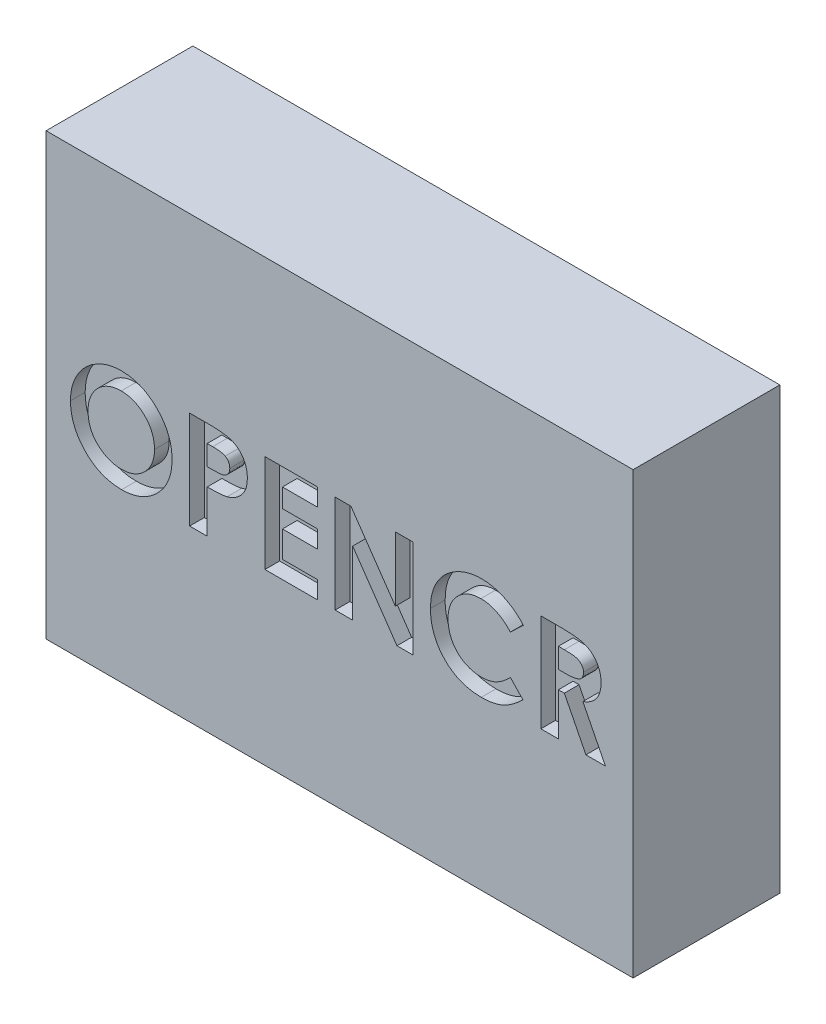
from build123d import *

# Parameters (mm, degrees)
SKETCH_1_W          = 120
SKETCH_1_H          = 90
EXTRUDE_1_DEPTH     = 30
CUT_EXTRUDE_1_DEPTH = 3


with BuildPart() as part:
    # ｽｹｯﾁ1 → ﾎﾞｽ - 押し出し1 (new body)
    with BuildSketch(Plane.XY):
        with Locations((60, 45)):
            Rectangle(SKETCH_1_W, SKETCH_1_H)
    extrude(amount=EXTRUDE_1_DEPTH)

    # ｽｹｯﾁ2 → ｶｯﾄ - 押し出し1 (cut)
    # profile 1 of 6: a face of its own
    with BuildSketch(Plane.XY.offset(30)):
        with BuildLine():
            add(Edge.make_bspline(
                [(15.404571472, 55.195485173), (15.752295983, 55.186481963), (16.438782926, 55.168707587), (17.448357493, 55.020544288), (18.421269257, 54.779133434), (19.357078271, 54.443554885), (20.253441377, 54.00471947), (21.113520348, 53.47506846), (21.934234421, 52.84460501), (22.707173578, 52.128036792), (23.421508761, 51.348800144), (24.040480614, 50.509813354), (24.568317103, 49.632815414), (25.005789397, 48.715456382), (25.339005976, 47.75138311), (25.572837832, 46.745511096), (25.723063215, 45.698126502), (25.740341445, 44.985000353), (25.749122754, 44.622568507)],
                knots=[0, 0, 0, 0, 1.014329547, 2.002516266, 2.970391464, 3.935626869, 4.897733899, 5.877609409, 6.878433252, 7.912639331, 8.949961323, 9.958554974, 10.949718813, 11.932905612, 12.9188844, 13.919928257, 14.942845884, 16, 16, 16, 16], degree=3))
            add(Edge.make_bspline(
                [(25.749122754, 44.622568507), (25.73977104, 44.26422043), (25.721343188, 43.558084047), (25.57897069, 42.520351514), (25.341201076, 41.525254485), (25.013636111, 40.570540535), (24.584097911, 39.660833971), (24.066554808, 38.790326442), (23.447349825, 37.967096467), (22.749067799, 37.191585823), (21.980319888, 36.487643508), (21.166093813, 35.867295557), (20.310149167, 35.341636115), (19.41373878, 34.910905957), (18.474940342, 34.576632144), (17.496072802, 34.34077768), (16.47719673, 34.19744416), (15.784311591, 34.179136676), (15.432616344, 34.169844148)],
                knots=[0, 0, 0, 0, 1.051557043, 2.072126891, 3.067553643, 4.050577992, 5.02905126, 6.015227836, 7.017913613, 8.04756643, 9.074058332, 10.072836633, 11.047628519, 12.017157415, 12.98668631, 13.966869689, 14.968021931, 16, 16, 16, 16], degree=3))
            add(Edge.make_bspline(
                [(15.432616344, 34.169844148), (15.064785285, 34.178180004), (14.342047533, 34.194558822), (13.284317597, 34.350313903), (12.270920923, 34.584935466), (11.310370626, 34.935095562), (10.392884322, 35.372825125), (9.525203054, 35.911915326), (8.707618419, 36.551475276), (7.944820215, 37.275125608), (7.253723196, 38.066957792), (6.643694517, 38.903458275), (6.129121793, 39.778236929), (5.709986199, 40.69170317), (5.379556533, 41.638180026), (5.146475948, 42.623431816), (5.008789684, 43.645095548), (4.989610787, 44.339029978), (4.979891985, 44.690677481)],
                knots=[0, 0, 0, 0, 1.067978421, 2.098431617, 3.099715153, 4.085208694, 5.062210972, 6.048429807, 7.046490867, 8.072918869, 9.098532598, 10.095778865, 11.076610158, 12.041847152, 13.011192615, 13.984257998, 14.978533688, 16, 16, 16, 16], degree=3))
            add(Edge.make_bspline(
                [(4.979891985, 44.690677481), (4.982942305, 44.927247512), (4.98900432, 45.397392056), (5.062027687, 46.094122271), (5.167160339, 46.777253248), (5.322646543, 47.444061334), (5.511522541, 48.099250548), (5.756238077, 48.736722229), (6.034790582, 49.363286327), (6.360252958, 49.971542334), (6.722135651, 50.555893788), (7.116981888, 51.113584201), (7.545784505, 51.63787028), (8.007162187, 52.132197417), (8.502704903, 52.593316365), (9.025894301, 53.027754904), (9.586877209, 53.423972802), (10.173375472, 53.79164649), (10.782082546, 54.124127429), (11.410520443, 54.407125262), (12.045742099, 54.654262448), (12.69623322, 54.849314043), (13.355022635, 55.008181527), (14.029148177, 55.11324332), (14.712519502, 55.186264664), (15.173340023, 55.192404376), (15.404571472, 55.195485173)],
                knots=[0, 0, 0, 0, 1.034744296, 2.056386356, 3.06226378, 4.057406941, 5.050368692, 6.043467995, 7.042652155, 8.049140477, 9.059438543, 10.048523776, 11.036952808, 12.020949711, 13.004946614, 13.997082645, 14.994316842, 16.007702937, 17.024872941, 18.026463647, 19.021641123, 20.005082605, 20.995858141, 21.984425357, 22.988620895, 24, 24, 24, 24], degree=3))
        make_face()
        with BuildLine():
            add(Edge.make_bspline(
                [(15.348481728, 51.605741584), (15.114463178, 51.59946234), (14.652604206, 51.587069627), (13.975141206, 51.492653914), (13.324752801, 51.341861288), (12.705044352, 51.123440013), (12.113329988, 50.845445164), (11.548560782, 50.508848091), (11.018557622, 50.102078644), (10.516253426, 49.646974463), (10.06250424, 49.139883815), (9.661602521, 48.596449947), (9.326112354, 48.017580382), (9.045137237, 47.408652684), (8.833625247, 46.762819621), (8.682971598, 46.085140073), (8.587764116, 45.374446365), (8.575763094, 44.889967389), (8.569635574, 44.642600558)],
                knots=[0, 0, 0, 0, 1.033739768, 2.040188636, 3.016340934, 3.979330865, 4.937572243, 5.900995986, 6.878200029, 7.884839167, 8.891893314, 9.879764717, 10.863503415, 11.843163062, 12.837761627, 13.859916423, 14.907309254, 16, 16, 16, 16], degree=3))
            add(Edge.make_bspline(
                [(8.569635574, 44.642600558), (8.577759731, 44.368462464), (8.59368173, 43.831197223), (8.705710858, 43.047449165), (8.897381544, 42.307276912), (9.174150288, 41.614300534), (9.517416141, 40.960825048), (9.943697852, 40.354859726), (10.446091673, 39.79277633), (10.833131803, 39.46460863), (11.029571472, 39.298049276)],
                knots=[0, 0, 0, 0, 1.078454662, 2.113592447, 3.107694534, 4.079536787, 5.043276885, 6.005368276, 6.987637804, 8, 8, 8, 8], degree=3))
            add(Edge.make_bspline(
                [(11.029571472, 39.298049276), (11.190493063, 39.175001622), (11.508710656, 38.931678598), (12.016655215, 38.619810227), (12.539738091, 38.352507923), (13.081906602, 38.136530823), (13.642015714, 37.966646866), (14.219988621, 37.847679925), (14.815006382, 37.773017881), (15.217385278, 37.764094352), (15.420597113, 37.759587737)],
                knots=[0, 0, 0, 0, 1.023928204, 2.024787132, 3.009472467, 3.9914905, 4.972207045, 5.96565515, 6.972602802, 8, 8, 8, 8], degree=3))
            add(Edge.make_bspline(
                [(15.420597113, 37.759587737), (15.650591708, 37.765920222), (16.103113308, 37.778379583), (16.767964969, 37.871632987), (17.404913053, 38.029451416), (18.017911788, 38.245956623), (18.605193559, 38.527441937), (19.163888161, 38.874479196), (19.694975138, 39.282807229), (20.196639404, 39.743887925), (20.655184258, 40.252976159), (21.055249379, 40.799308648), (21.401406457, 41.370848051), (21.676538692, 41.975683643), (21.896407043, 42.608106058), (22.045247496, 43.270916159), (22.141259266, 43.961381592), (22.153263669, 44.43126772), (22.159379164, 44.67064543)],
                knots=[0, 0, 0, 0, 1.026359118, 2.019393844, 2.989460624, 3.950973911, 4.916101784, 5.890408035, 6.881132271, 7.902007068, 8.92769091, 9.933912415, 10.920395702, 11.90457117, 12.894218921, 13.903490204, 14.931958862, 16, 16, 16, 16], degree=3))
            add(Edge.make_bspline(
                [(22.159379164, 44.67064543), (22.153052072, 44.908646652), (22.140598155, 45.377115761), (22.04718062, 46.065806011), (21.890363035, 46.725690001), (21.673207685, 47.357845388), (21.395911803, 47.962891922), (21.053007314, 48.538701899), (20.645697428, 49.084718653), (20.183356355, 49.597221289), (19.680126514, 50.068178383), (19.139858997, 50.476883529), (18.577671097, 50.832035306), (17.980663478, 51.110246868), (17.361050419, 51.331897428), (16.715051006, 51.495124082), (16.040218478, 51.586406352), (15.581115956, 51.599239057), (15.348481728, 51.605741584)],
                knots=[0, 0, 0, 0, 1.055025985, 2.07665775, 3.074803781, 4.057872707, 5.035505728, 6.020516407, 7.023567878, 8.050795229, 9.077271434, 10.074415901, 11.050397877, 12.019801805, 12.988065821, 13.964604439, 14.968634123, 16, 16, 16, 16], degree=3))
        make_face(mode=Mode.SUBTRACT)
    # profile 2 of 6: a face of its own
    with BuildSketch(Plane.XY.offset(30)):
        with BuildLine():
            Line((29.338866344, 54.68266466), (33.3452766, 54.68266466))
            add(Edge.make_bspline(
                [(33.3452766, 54.68266466), (33.607050249, 54.681492906), (34.112066488, 54.679232346), (34.840341455, 54.651820047), (35.51221077, 54.602695537), (36.127520073, 54.541985411), (36.686016363, 54.456872178), (37.188399046, 54.35929652), (37.634772377, 54.240420969), (38.03016988, 54.099317339), (38.385026368, 53.932961671), (38.720835057, 53.75578101), (39.030006633, 53.54432214), (39.328145922, 53.321375201), (39.598207784, 53.065642156), (39.857040297, 52.794142411), (40.093681196, 52.496108509), (40.309226989, 52.17514807), (40.504760236, 51.837191072), (40.675591161, 51.481633346), (40.814159641, 51.107912261), (40.930401365, 50.718445366), (41.023767851, 50.313249636), (41.085915556, 49.88983308), (41.128129404, 49.451152155), (41.131854193, 49.15258564), (41.133738139, 49.001574917)],
                knots=[0, 0, 0, 0, 1.698747864, 3.27724071, 4.728299578, 6.070144658, 7.288476769, 8.393259625, 9.389771311, 10.283485332, 11.113357557, 11.931608583, 12.74405601, 13.541433047, 14.344816069, 15.154114104, 15.974336324, 16.810834471, 17.661136416, 18.50621059, 19.367396281, 20.244825668, 21.142564693, 22.063065223, 23.020325768, 24, 24, 24, 24], degree=3))
            add(Edge.make_bspline(
                [(41.133738139, 49.001574917), (41.131012305, 48.83451535), (41.125655707, 48.506222771), (41.073143785, 48.024986127), (40.983436832, 47.566170558), (40.866194536, 47.125906789), (40.702708492, 46.711438136), (40.515933364, 46.312875249), (40.286140714, 45.941392608), (40.023565875, 45.592343413), (39.736804195, 45.262889729), (39.419047964, 44.962543909), (39.076353752, 44.689258504), (38.710705295, 44.440169464), (38.320729836, 44.215779255), (37.906708764, 44.013986702), (37.465814907, 43.841245756), (37.15878969, 43.75090364), (37.003129164, 43.705100558)],
                knots=[0, 0, 0, 0, 1.102006807, 2.165578795, 3.188629044, 4.184801286, 5.166646146, 6.124351954, 7.085497154, 8.042432466, 9.003981491, 9.963833307, 10.922997304, 11.89326795, 12.880200226, 13.889073926, 14.929769137, 16, 16, 16, 16], degree=3))
            add(Edge.make_bspline(
                [(37.003129164, 43.705100558), (36.900602188, 43.67959168), (36.678495741, 43.624331237), (36.310970576, 43.568228017), (35.887436411, 43.516644555), (35.406523684, 43.472314815), (34.867955138, 43.442180921), (34.272252246, 43.41864769), (33.619145047, 43.401536601), (33.165000127, 43.400929424), (32.928609933, 43.400613378)],
                knots=[0, 0, 0, 0, 0.618981996, 1.340914327, 2.176866532, 3.120127938, 4.170906482, 5.338178032, 6.614476169, 8, 8, 8, 8], degree=3))
            Line((32.928609933, 43.400613378), (32.928609933, 34.68266466))
            Line((32.928609933, 34.68266466), (29.338866344, 34.68266466))
            Line((29.338866344, 34.68266466), (29.338866344, 54.68266466))
        make_face()
        with BuildLine():
            Line((32.928609933, 46.990356968), (34.198641985, 46.990356968))
            add(Edge.make_bspline(
                [(34.198641985, 46.990356968), (34.429744367, 46.991822337), (34.854976185, 46.994518636), (35.435692684, 47.033508698), (35.902367633, 47.093054399), (36.271049509, 47.178456704), (36.562158771, 47.30806601), (36.813222283, 47.457999571), (37.028565868, 47.647586443), (37.215021716, 47.864221883), (37.364087548, 48.113146862), (37.467456938, 48.390308119), (37.534603662, 48.6898822), (37.540805285, 48.898365932), (37.543994549, 49.005581327)],
                knots=[0, 0, 0, 0, 1.8619151, 3.425951444, 4.686033666, 5.651700536, 6.461346321, 7.243864085, 7.999046032, 8.762387399, 9.539336099, 10.322741239, 11.137448474, 12, 12, 12, 12], degree=3))
            add(Edge.make_bspline(
                [(37.543994549, 49.005581327), (37.540838091, 49.099254022), (37.534713805, 49.281001572), (37.489723131, 49.543308366), (37.418020937, 49.787832411), (37.314127216, 50.012019974), (37.179817234, 50.215490127), (37.016066187, 50.398162715), (36.824975322, 50.563949825), (36.677442001, 50.651703475), (36.602488139, 50.696286455)],
                knots=[0, 0, 0, 0, 1.102301479, 2.1387299, 3.123554645, 4.094223062, 5.036071848, 5.982632524, 6.975082478, 8, 8, 8, 8], degree=3))
            add(Edge.make_bspline(
                [(36.602488139, 50.696286455), (36.53899789, 50.728395295), (36.404576023, 50.796376287), (36.175642552, 50.875409161), (35.911456822, 50.942082097), (35.610235282, 50.99741999), (35.273179591, 51.040367942), (34.900349886, 51.073212381), (34.491197512, 51.08642041), (34.206656518, 51.090694417), (34.058417626, 51.092921071)],
                knots=[0, 0, 0, 0, 0.656809284, 1.390599849, 2.23162475, 3.173112763, 4.218524733, 5.370385145, 6.63003504, 8, 8, 8, 8], degree=3))
            Line((34.058417626, 51.092921071), (32.928609933, 51.092921071))
            Line((32.928609933, 51.092921071), (32.928609933, 46.990356968))
        make_face(mode=Mode.SUBTRACT)
    # profile 3 of 6: a face of its own
    with BuildSketch(Plane.XY.offset(30)):
        Polygon((44.723481728, 54.68266466), (55.492712497, 54.68266466), (55.492712497, 51.092921071), (48.313225318, 51.092921071), (48.313225318, 47.246767225), (55.492712497, 47.246767225), (55.492712497, 43.657023635), (48.313225318, 43.657023635), (48.313225318, 38.27240825), (55.492712497, 38.27240825), (55.492712497, 34.68266466), (44.723481728, 34.68266466), align=None)
    # profile 4 of 6: a face of its own
    with BuildSketch(Plane.XY.offset(30)):
        Polygon((59.082456087, 54.68266466), (62.315629164, 54.68266466), (71.390148395, 41.521606968), (71.390148395, 54.68266466), (74.979891985, 54.68266466), (74.979891985, 34.68266466), (71.722680446, 34.68266466), (62.672199677, 47.80365825), (62.672199677, 34.68266466), (59.082456087, 34.68266466), align=None)
    # profile 5 of 6: a face of its own
    with BuildSketch(Plane.XY.offset(30)):
        with BuildLine():
            Line((97.543994549, 51.213113378), (94.91178301, 48.697087737))
            add(Edge.make_bspline(
                [(94.91178301, 48.697087737), (94.688497383, 48.92796545), (94.252350601, 49.378941954), (93.549554001, 49.975995102), (92.818671127, 50.473558116), (92.073919845, 50.892602519), (91.301904239, 51.209639475), (90.511550911, 51.440669645), (89.697813224, 51.581520008), (89.147106856, 51.597635782), (88.870116344, 51.605741584)],
                knots=[0, 0, 0, 0, 1.115251505, 2.178435587, 3.19620269, 4.182487026, 5.141301733, 6.088180966, 7.038406374, 8, 8, 8, 8], degree=3))
            add(Edge.make_bspline(
                [(88.870116344, 51.605741584), (88.638795605, 51.599337717), (88.182309614, 51.586700392), (87.512068557, 51.494056334), (86.870948348, 51.336511081), (86.256754329, 51.11938454), (85.671293794, 50.838434319), (85.113339252, 50.493877868), (84.584266316, 50.08882702), (84.091063733, 49.625377528), (83.639899343, 49.119024132), (83.241266878, 48.578746265), (82.907348244, 48.005781676), (82.633306652, 47.405932927), (82.419838846, 46.776423622), (82.267396013, 46.117677572), (82.179227152, 45.428910261), (82.166067358, 44.960691375), (82.159379164, 44.722728763)],
                knots=[0, 0, 0, 0, 1.035432265, 2.043311493, 3.022114605, 3.98653278, 4.95457646, 5.923598177, 6.917315552, 7.932509744, 8.948865224, 9.949768934, 10.933144597, 11.912367597, 12.897413939, 13.903909035, 14.934704909, 16, 16, 16, 16], degree=3))
            add(Edge.make_bspline(
                [(82.159379164, 44.722728763), (82.161306625, 44.555709952), (82.165105691, 44.226512445), (82.206693184, 43.739537966), (82.273658855, 43.267057595), (82.370574771, 42.809787015), (82.491769077, 42.367329949), (82.633957594, 41.935869344), (82.812330997, 41.521367014), (83.010328165, 41.119008783), (83.24059659, 40.739773499), (83.488868431, 40.378141182), (83.758078708, 40.035884518), (84.049971112, 39.714402662), (84.368653665, 39.418719656), (84.705889603, 39.139943959), (85.067367628, 38.885054273), (85.445578927, 38.647653858), (85.843790767, 38.441422099), (86.251198737, 38.254615967), (86.673979964, 38.102901614), (87.106986832, 37.980606005), (87.548671927, 37.876611854), (88.00335534, 37.812579459), (88.467095534, 37.764088476), (88.780506067, 37.761094441), (88.938225318, 37.759587737)],
                knots=[0, 0, 0, 0, 1.103660481, 2.175337485, 3.227646561, 4.255952547, 5.262355991, 6.258840057, 7.255597736, 8.242457506, 9.22035537, 10.185017736, 11.140346927, 12.096287581, 13.051739095, 14.01125915, 14.986044842, 15.97314143, 16.960198552, 17.947847494, 18.933482797, 19.925264591, 20.920966487, 21.929612487, 22.958107872, 24, 24, 24, 24], degree=3))
            add(Edge.make_bspline(
                [(88.938225318, 37.759587737), (89.205744272, 37.767325805), (89.731349451, 37.782529096), (90.502750626, 37.901416679), (91.237819096, 38.096980025), (91.825135286, 38.327928974), (92.285282008, 38.555994059), (92.635584905, 38.766943031), (92.997825402, 39.002912618), (93.365986996, 39.272808566), (93.744210774, 39.573392017), (94.125820213, 39.911246308), (94.520584584, 40.275246383), (94.77919081, 40.535040388), (94.91178301, 40.668241584)],
                knots=[0, 0, 0, 0, 1.404581149, 2.759636711, 4.088442092, 5.392261763, 6.066678138, 6.783632037, 7.538459478, 8.336747902, 9.180226004, 10.074962426, 11.012997595, 12, 12, 12, 12], degree=3))
            Line((94.91178301, 40.668241584), (97.463866344, 37.987953122))
            add(Edge.make_bspline(
                [(97.463866344, 37.987953122), (97.284468622, 37.814750254), (96.934322635, 37.476695296), (96.406137134, 36.996688801), (95.878616375, 36.565349605), (95.364504162, 36.167021986), (94.855378798, 35.813310195), (94.351294278, 35.503860975), (93.857957057, 35.230847908), (93.36512283, 34.998875225), (92.869724929, 34.801906325), (92.360018706, 34.63232903), (91.834445941, 34.48887274), (91.289796675, 34.373122353), (90.731151065, 34.28030617), (90.153280931, 34.217655783), (89.559850254, 34.175538012), (89.157317032, 34.171753382), (88.954250959, 34.169844148)],
                knots=[0, 0, 0, 0, 1.244526981, 2.429050516, 3.560637417, 4.644440555, 5.67424972, 6.652764056, 7.595344123, 8.486817594, 9.369275933, 10.254498637, 11.166417451, 12.086725134, 13.032340136, 13.991389299, 14.986715468, 16, 16, 16, 16], degree=3))
            add(Edge.make_bspline(
                [(88.954250959, 34.169844148), (88.581243736, 34.179352846), (87.851372286, 34.197958724), (86.781764705, 34.335815689), (85.765666215, 34.566930463), (84.800604838, 34.893790499), (83.886887442, 35.311338876), (83.024747784, 35.82323358), (82.21557544, 36.428114587), (81.465906931, 37.118892106), (80.787796087, 37.881797884), (80.188424629, 38.700949394), (79.692624537, 39.580372465), (79.280951037, 40.50707521), (78.959027774, 41.485286533), (78.732448372, 42.51606456), (78.592718509, 43.598414012), (78.577431863, 44.337683638), (78.569635574, 44.714715943)],
                knots=[0, 0, 0, 0, 1.078019885, 2.10938526, 3.111377082, 4.085535484, 5.04941344, 6.010039228, 6.978205633, 7.964457913, 8.951525778, 9.924444315, 10.892603023, 11.863865945, 12.85144698, 13.863884204, 14.910567087, 16, 16, 16, 16], degree=3))
            add(Edge.make_bspline(
                [(78.569635574, 44.714715943), (78.572929908, 44.960613195), (78.579458472, 45.44792145), (78.648074286, 46.16576599), (78.74372872, 46.865536014), (78.895475781, 47.53996559), (79.078391897, 48.198140529), (79.30587212, 48.832907237), (79.577553132, 49.446090097), (79.884678014, 50.038715615), (80.232125321, 50.606901459), (80.620262106, 51.145766017), (81.039096213, 51.659469224), (81.498691545, 52.141195853), (81.992369579, 52.595175558), (82.522359215, 53.018948136), (83.08547283, 53.418590963), (83.683234562, 53.783798221), (84.304031496, 54.114147598), (84.940033746, 54.405529857), (85.58967873, 54.649058326), (86.25021969, 54.851056207), (86.924447403, 55.001833342), (87.607549403, 55.115966769), (88.305338068, 55.179768085), (88.773842705, 55.190212768), (89.010340703, 55.195485173)],
                knots=[0, 0, 0, 0, 1.071919942, 2.124283339, 3.142214191, 4.149696895, 5.136002878, 6.119640489, 7.086990633, 8.058538607, 9.028339693, 9.988281803, 10.952401235, 11.916291999, 12.888973767, 13.874849856, 14.873389453, 15.898127285, 16.927174885, 17.938320013, 18.946391617, 19.950418109, 20.947802303, 21.956882652, 22.968648068, 24, 24, 24, 24], degree=3))
            add(Edge.make_bspline(
                [(89.010340703, 55.195485173), (89.212097744, 55.192462899), (89.613514115, 55.186449773), (90.211290452, 55.136323827), (90.804286054, 55.057601537), (91.390377814, 54.938826365), (91.97375806, 54.797825226), (92.546760522, 54.613203685), (93.118424623, 54.407408185), (93.679784662, 54.161421685), (94.231624213, 53.892905201), (94.761015568, 53.588263499), (95.276847156, 53.266243889), (95.767688461, 52.907787838), (96.242733997, 52.525897215), (96.699499709, 52.118790286), (97.133977211, 51.679679382), (97.406631167, 51.369421608), (97.543994549, 51.213113378)],
                knots=[0, 0, 0, 0, 0.996412454, 1.982464992, 2.961075852, 3.949442424, 4.934965278, 5.923860011, 6.921385422, 7.934793307, 8.949617135, 9.951082467, 10.950285876, 11.951772932, 12.951063433, 13.960125323, 14.972308753, 16, 16, 16, 16], degree=3))
        make_face()
    # profile 6 of 6: a face of its own
    with BuildSketch(Plane.XY.offset(30)):
        with BuildLine():
            Line((101.133738139, 54.68266466), (105.316430446, 54.68266466))
            add(Edge.make_bspline(
                [(105.316430446, 54.68266466), (105.592905135, 54.681683334), (106.124643839, 54.679795967), (106.891382008, 54.650018311), (107.59573646, 54.60858026), (108.238750055, 54.545344693), (108.820147701, 54.461501975), (109.340512096, 54.362665285), (109.799828029, 54.250019687), (110.201969196, 54.109654384), (110.564881713, 53.95132445), (110.903166634, 53.769400454), (111.224287026, 53.565908174), (111.526096548, 53.335493181), (111.811217993, 53.082300581), (112.080189262, 52.806075512), (112.32920954, 52.5044757), (112.556736885, 52.179406872), (112.764109745, 51.837441919), (112.947383859, 51.478111321), (113.096422674, 51.101165187), (113.228114443, 50.712051205), (113.322967758, 50.305206913), (113.388936851, 49.88459301), (113.437236841, 49.448728889), (113.440013859, 49.152622158), (113.441430446, 49.001574917)],
                knots=[0, 0, 0, 0, 1.749336639, 3.364467119, 4.854658419, 6.213483162, 7.451590619, 8.570285859, 9.5643256, 10.440900261, 11.26203566, 12.067320669, 12.869050712, 13.665104639, 14.467235401, 15.27997916, 16.102287765, 16.939272006, 17.78853747, 18.631303466, 19.488103222, 20.351255419, 21.228522269, 22.127379805, 23.044756219, 24, 24, 24, 24], degree=3))
            add(Edge.make_bspline(
                [(113.441430446, 49.001574917), (113.437750662, 48.843916296), (113.430535277, 48.534776476), (113.391669285, 48.080675294), (113.320634461, 47.646223045), (113.213041887, 47.232691754), (113.089378197, 46.83493454), (112.924937212, 46.460290273), (112.739349307, 46.103310296), (112.518931974, 45.769044224), (112.27703472, 45.450067342), (111.995713301, 45.158600835), (111.693193026, 44.878979485), (111.352468126, 44.628717822), (110.988558073, 44.390894059), (110.594232357, 44.175362394), (110.172064481, 43.976704858), (109.875259558, 43.865919694), (109.723481728, 43.809267225)],
                knots=[0, 0, 0, 0, 1.099860209, 2.156625411, 3.176576793, 4.16617041, 5.135385252, 6.078461593, 7.016046972, 7.938469504, 8.868247731, 9.803980173, 10.76021508, 11.73834243, 12.748633912, 13.790971185, 14.870363756, 16, 16, 16, 16], degree=3))
            Line((109.723481728, 43.809267225), (114.338866344, 34.68266466))
            Line((114.338866344, 34.68266466), (110.348481728, 34.68266466))
            Line((110.348481728, 34.68266466), (105.941430446, 43.400613378))
            Line((105.941430446, 43.400613378), (104.723481728, 43.400613378))
            Line((104.723481728, 43.400613378), (104.723481728, 34.68266466))
            Line((104.723481728, 34.68266466), (101.133738139, 34.68266466))
            Line((101.133738139, 34.68266466), (101.133738139, 54.68266466))
        make_face()
        with BuildLine():
            Line((104.723481728, 46.990356968), (106.121718908, 46.990356968))
            add(Edge.make_bspline(
                [(106.121718908, 46.990356968), (106.292665026, 46.992282278), (106.61999011, 46.995968833), (107.090726573, 47.013068604), (107.518267545, 47.054270602), (107.904449033, 47.106327786), (108.251214267, 47.166435323), (108.555470222, 47.252573072), (108.821905019, 47.344871852), (109.047361396, 47.459575292), (109.239986144, 47.590017982), (109.406305285, 47.73820412), (109.543875062, 47.909710706), (109.657102005, 48.09987693), (109.745180257, 48.310384767), (109.809470633, 48.538923317), (109.845399446, 48.788095928), (109.849533178, 48.960058957), (109.851686856, 49.04965184)],
                knots=[0, 0, 0, 0, 1.688639943, 3.233382647, 4.650958383, 5.928841754, 7.082724185, 8.122798841, 9.049171256, 9.863274652, 10.613301712, 11.341792392, 12.054588806, 12.776240173, 13.521029143, 14.301969904, 15.115324896, 16, 16, 16, 16], degree=3))
            add(Edge.make_bspline(
                [(109.851686856, 49.04965184), (109.847615131, 49.155646761), (109.83961698, 49.363854141), (109.760250481, 49.663599761), (109.633916157, 49.941034841), (109.460746401, 50.19490586), (109.242661607, 50.41746672), (108.992392099, 50.613655891), (108.704536459, 50.768787608), (108.438003796, 50.871110836), (108.195521374, 50.93233188), (107.976688637, 50.97795326), (107.723279011, 51.010286441), (107.435101185, 51.044581535), (107.112889733, 51.066820168), (106.754888411, 51.083049937), (106.362125396, 51.089690333), (106.088332271, 51.091813151), (105.945436856, 51.092921071)],
                knots=[0, 0, 0, 0, 1.020303359, 2.004196876, 2.966617323, 3.9489082, 4.950758222, 5.960522915, 7.003732012, 8.091992268, 8.70421221, 9.413913587, 10.24622431, 11.166358409, 12.212345909, 13.359657661, 14.621978493, 16, 16, 16, 16], degree=3))
            Line((105.945436856, 51.092921071), (104.723481728, 51.092921071))
            Line((104.723481728, 51.092921071), (104.723481728, 46.990356968))
        make_face(mode=Mode.SUBTRACT)
    extrude(amount=-CUT_EXTRUDE_1_DEPTH, mode=Mode.SUBTRACT)


solid = part.part
